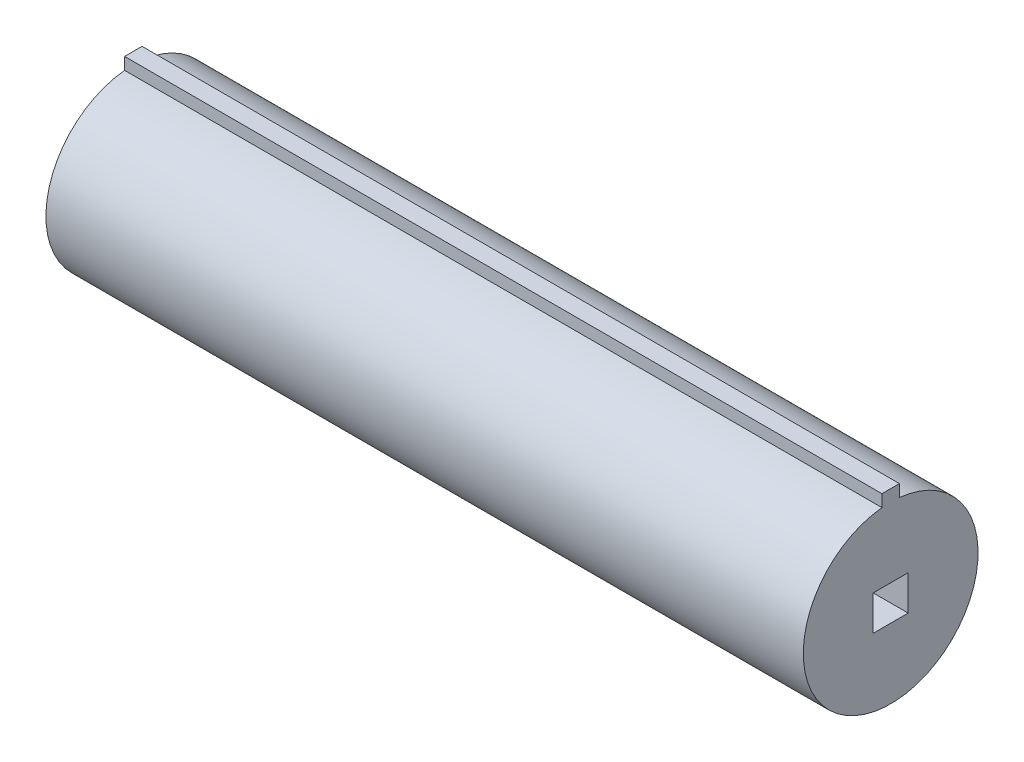
from build123d import *

# Parameters (mm, degrees)
EXTRUDE_1_DEPTH     = 130
SKETCH_2_W          = 6
SKETCH_2_H          = 6
CUT_EXTRUDE_1_DEPTH = 15


with BuildPart() as part:
    # 草图1 → 凸台-拉伸1 (new body)
    with BuildSketch(Plane(origin=(0, 0, 0), x_dir=(0, 0, -1), z_dir=(1, 0, 0))):
        with BuildLine():
            Line((-1.5, 14.924811557), (-1.5, 0))
            Line((-1.5, 0), (1.5, 0))
            Line((1.5, 0), (1.5, 14.924811557))
            ThreePointArc((1.5, 14.924811557), (0, 15), (-1.5, 14.924811557))
        make_face()
        with BuildLine():
            Line((1.5, 0), (-1.5, 0))
            Line((-1.5, 0), (-1.5, 14.924811557))
            ThreePointArc((-1.5, 14.924811557), (-10.062305899, -11.124297731), (15, 0))
            ThreePointArc((15, 0), (11.124297731, 10.062305899), (1.5, 14.924811557))
            Line((1.5, 14.924811557), (1.5, 0))
        make_face()
        with BuildLine():
            Line((-1.5, 17), (-1.5, 14.924811557))
            ThreePointArc((-1.5, 14.924811557), (0, 15), (1.5, 14.924811557))
            Line((1.5, 14.924811557), (1.5, 17))
            Line((1.5, 17), (-1.5, 17))
        make_face()
    extrude(amount=EXTRUDE_1_DEPTH)

    # 草图2 → 切除-拉伸1 (cut)
    with BuildSketch(Plane(origin=(130, 0, 0), x_dir=(0, 0, -1), z_dir=(1, 0, 0))):
        Rectangle(SKETCH_2_W, SKETCH_2_H)
    extrude(amount=-CUT_EXTRUDE_1_DEPTH, mode=Mode.SUBTRACT)


solid = part.part
